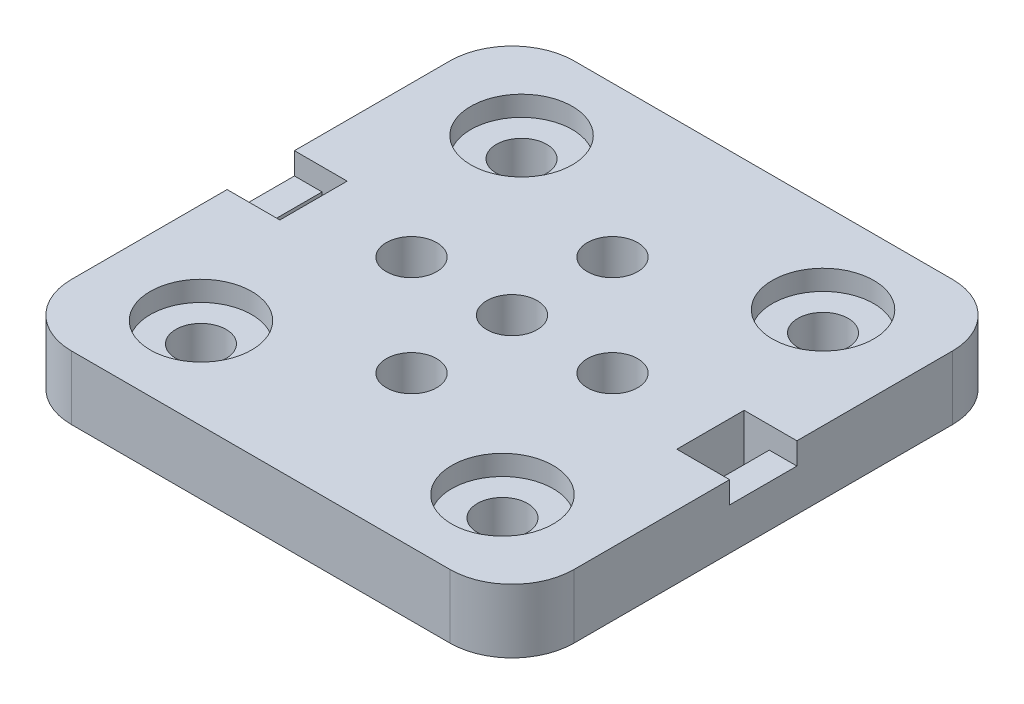
from build123d import *

# Parameters (mm, degrees)
SKETCH1_W           = 2.5
SKETCH1_H           = 6.7
SKETCH1_R           = 2.51
SKETCH1_R_2         = 2.5
BOSS_EXTRUDE1_DEPTH = 6.35
SKETCH1_4_W         = 2.75
SKETCH1_4_H         = 6.7
CUT_EXTRUDE1_DEPTH  = 2.18
SKETCH1_5_R         = 5.05
SKETCH1_5_R_2       = 2.5
CUT_EXTRUDE2_DEPTH  = 2


with BuildPart() as part:
    # Sketch1 → Boss-Extrude1 (new body)
    with BuildSketch(Plane(origin=(0, 0, 0), x_dir=(1, 0, 0), z_dir=(0, 1, 0))):
        with BuildLine():
            ThreePointArc((0, 6.17), (1.80715116, 1.80715116), (6.17, 0))
            Line((6.17, 0), (43.83, 0))
            ThreePointArc((43.83, 0), (48.19284884, 1.80715116), (50, 6.17))
            Line((50, 6.17), (50, 43.83))
            ThreePointArc((50, 43.83), (48.19284884, 48.19284884), (43.83, 50))
            Line((43.83, 50), (6.17, 50))
            ThreePointArc((6.17, 50), (1.80715116, 48.19284884), (0, 43.83))
            Line((0, 43.83), (0, 6.17))
        make_face()
        with Locations((4, 25)):
            Rectangle(SKETCH1_W, SKETCH1_H, mode=Mode.SUBTRACT)
        with Locations((46, 25)):
            Rectangle(SKETCH1_W, SKETCH1_H, mode=Mode.SUBTRACT)
        with Locations((25, 15)):
            Circle(SKETCH1_R, mode=Mode.SUBTRACT)
        with Locations((15, 25)):
            Circle(SKETCH1_R, mode=Mode.SUBTRACT)
        with Locations((25, 25)):
            Circle(SKETCH1_R, mode=Mode.SUBTRACT)
        with Locations((35, 25)):
            Circle(SKETCH1_R, mode=Mode.SUBTRACT)
        with Locations((25, 35)):
            Circle(SKETCH1_R, mode=Mode.SUBTRACT)
        with Locations((10, 9.05)):
            Circle(SKETCH1_R_2, mode=Mode.SUBTRACT)
        with Locations((40, 9.05)):
            Circle(SKETCH1_R_2, mode=Mode.SUBTRACT)
        with Locations((10, 40.95)):
            Circle(SKETCH1_R_2, mode=Mode.SUBTRACT)
        with Locations((40, 40.95)):
            Circle(SKETCH1_R_2, mode=Mode.SUBTRACT)
    extrude(amount=-BOSS_EXTRUDE1_DEPTH)

    # Sketch1<4> → Cut-Extrude1 (cut)
    with BuildSketch(Plane(origin=(0, 0, 0), x_dir=(1, 0, 0), z_dir=(0, 1, 0))):
        with Locations((1.375, 25)):
            Rectangle(SKETCH1_4_W, SKETCH1_4_H)
        with Locations((48.625, 25)):
            Rectangle(SKETCH1_4_W, SKETCH1_4_H)
    extrude(amount=-CUT_EXTRUDE1_DEPTH, mode=Mode.SUBTRACT)

    # Sketch1<5> → Cut-Extrude2 (cut)
    # profile 1 of 4: a face of its own
    with BuildSketch(Plane(origin=(0, 0, 0), x_dir=(1, 0, 0), z_dir=(0, 1, 0))):
        with Locations((10, 9.05)):
            Circle(SKETCH1_5_R)
        with Locations((10, 9.05)):
            Circle(SKETCH1_5_R_2, mode=Mode.SUBTRACT)
    # profile 2 of 4: a face of its own
    with BuildSketch(Plane(origin=(0, 0, 0), x_dir=(1, 0, 0), z_dir=(0, 1, 0))):
        with Locations((40, 9.05)):
            Circle(SKETCH1_5_R)
        with Locations((40, 9.05)):
            Circle(SKETCH1_5_R_2, mode=Mode.SUBTRACT)
    # profile 3 of 4: a face of its own
    with BuildSketch(Plane(origin=(0, 0, 0), x_dir=(1, 0, 0), z_dir=(0, 1, 0))):
        with Locations((40, 40.95)):
            Circle(SKETCH1_5_R)
        with Locations((40, 40.95)):
            Circle(SKETCH1_5_R_2, mode=Mode.SUBTRACT)
    # profile 4 of 4: a face of its own
    with BuildSketch(Plane(origin=(0, 0, 0), x_dir=(1, 0, 0), z_dir=(0, 1, 0))):
        with Locations((10, 40.95)):
            Circle(SKETCH1_5_R)
        with Locations((10, 40.95)):
            Circle(SKETCH1_5_R_2, mode=Mode.SUBTRACT)
    extrude(amount=-CUT_EXTRUDE2_DEPTH, mode=Mode.SUBTRACT)


solid = part.part
